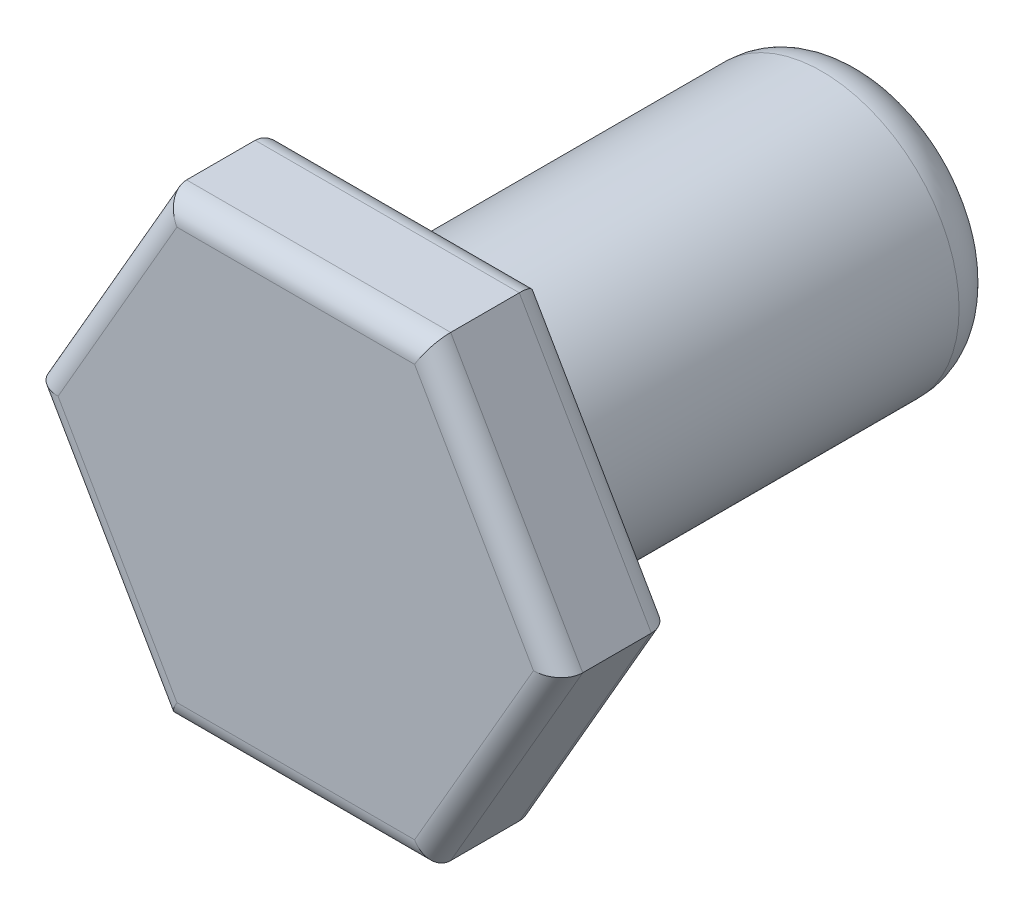
from build123d import *

# Parameters (mm, degrees)
SKETCH_1_R      = 6
EXTRUDE_1_DEPTH = 20
EXTRUDE_2_DEPTH = 5
FILLET_1_R      = 2
FILLET_2_R      = 1


with BuildPart() as part:
    # 草图1 → 凸台-拉伸1 (new body)
    with BuildSketch(Plane.XY):
        Circle(SKETCH_1_R)
    extrude(amount=EXTRUDE_1_DEPTH)

    # 草图2 → 凸台-拉伸2 (add)
    with BuildSketch(Plane.XY.offset(20)):
        Polygon((5.773502692, -10), (11.547005384, 0), (5.773502692, 10), (-5.773502692, 10), (-11.547005384, 0), (-5.773502692, -10), align=None)
    extrude(amount=EXTRUDE_2_DEPTH)

    # 圆角1
    fillet_1_edges = [part.edges().sort_by_distance(p)[0] for p in [
        (-6, 0, 0),
    ]]
    fillet(fillet_1_edges, radius=FILLET_1_R)

    # 圆角2
    fillet_2_edges = [part.edges().sort_by_distance(p)[0] for p in [
        (0, -10, 20),
        (8.660254038, -5, 20),
        (8.660254038, 5, 20),
        (0, 10, 20),
        (-8.660254038, 5, 20),
        (-8.660254038, -5, 20),
        (0, -10, 25),
        (8.660254038, -5, 25),
        (8.660254038, 5, 25),
        (0, 10, 25),
        (-8.660254038, 5, 25),
        (-8.660254038, -5, 25),
    ]]
    fillet(fillet_2_edges, radius=FILLET_2_R)


solid = part.part
